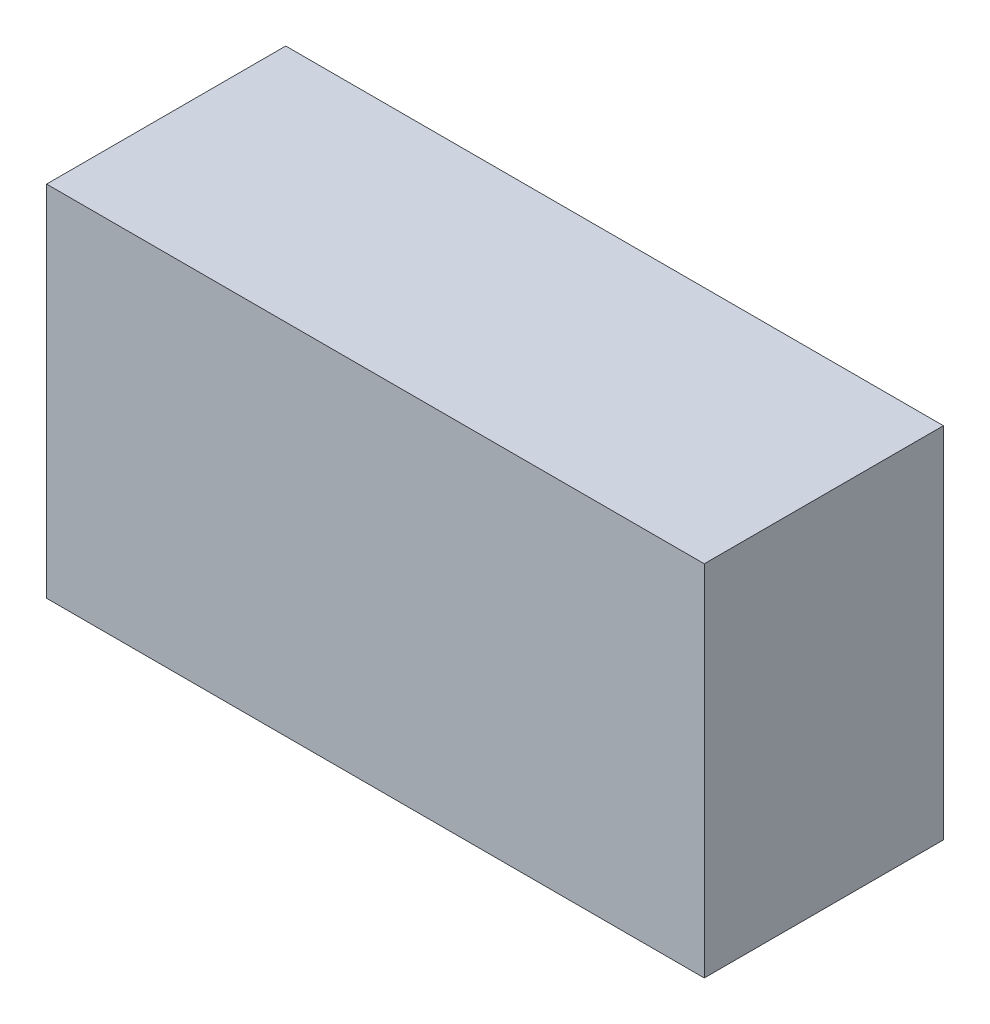
from build123d import *

# Parameters (mm, degrees)
SKETCH_1_W      = 33
SKETCH_1_H      = 18
EXTRUDE_1_DEPTH = 12
EXTRUDE_2_DEPTH = 2


with BuildPart() as part:
    # Эскиз1 → Бобышка-Вытянуть1 (new body)
    with BuildSketch(Plane.XY):
        with Locations((16.5, 9)):
            Rectangle(SKETCH_1_W, SKETCH_1_H)
    extrude(amount=EXTRUDE_1_DEPTH)

    # Эскиз2 → Бобышка-Вытянуть2 (add)
    with BuildSketch(Plane.ZY):
        with BuildLine():
            Line((2.7, 4.53), (3.3, 4.53))
            ThreePointArc((3.3, 4.53), (4.20509668, 4.90490332), (4.58, 5.81))
            Line((4.58, 5.81), (4.58, 12.19))
            ThreePointArc((4.58, 12.19), (4.20509668, 13.09509668), (3.3, 13.47))
            Line((3.3, 13.47), (2.7, 13.47))
            ThreePointArc((2.7, 13.47), (1.79490332, 13.09509668), (1.42, 12.19))
            Line((1.42, 12.19), (1.42, 5.81))
            ThreePointArc((1.42, 5.81), (1.79490332, 4.90490332), (2.7, 4.53))
        make_face()
    extrude(amount=EXTRUDE_2_DEPTH)


solid = part.part
